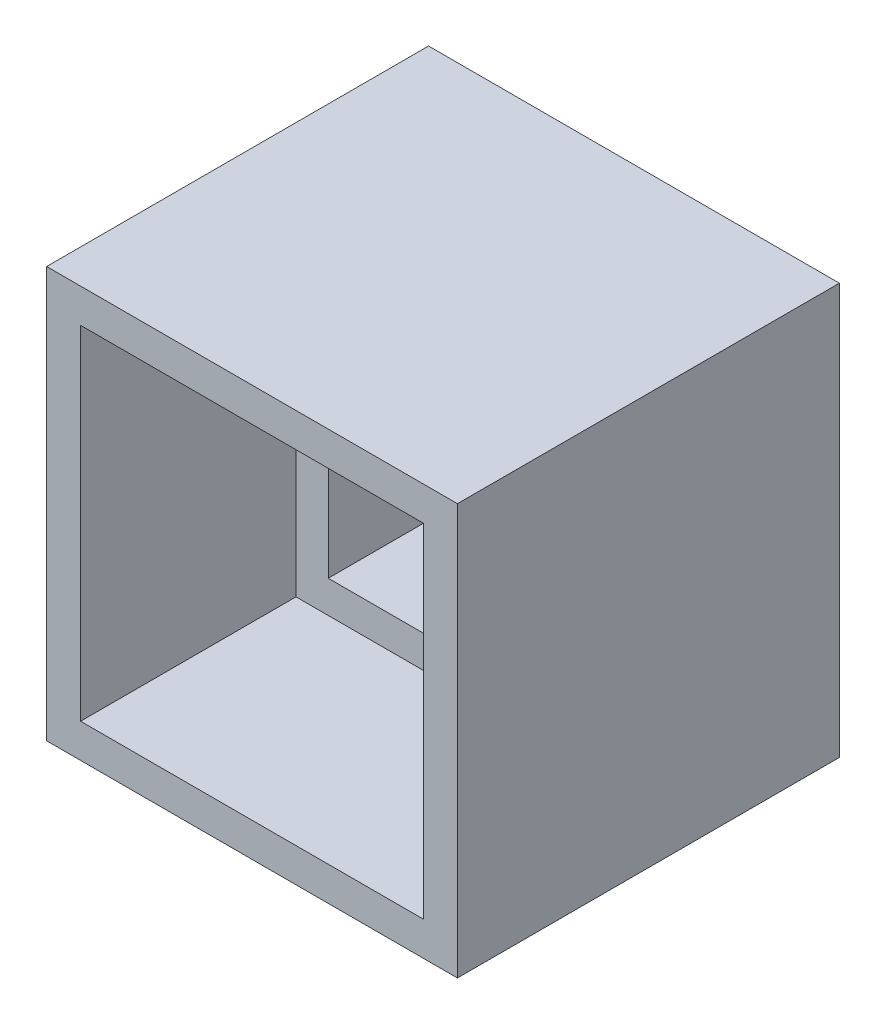
from build123d import *

# Parameters (mm, degrees)
BOSS_EXTRUDE1_DEPTH      = 50.8
BOSS_EXTRUDE1_DEPTH_BACK = 6.35
SKETCH1_W                = 61.468
SKETCH1_H                = 61.468
SKETCH1_3_W              = 41.656
SKETCH1_3_H              = 41.656
CUT_EXTRUDE1_DEPTH       = 67.856544272
SKETCH5_W                = 38.1
SKETCH5_H                = 38.1
CUT_EXTRUDE3_DEPTH       = 72.800278635
SKETCH7_W                = 51.308
SKETCH7_H                = 51.308
CUT_EXTRUDE4_DEPTH       = 55.111902709


with BuildPart() as part:
    # Sketch1 → Boss-Extrude1 (new, two sides: drawn at the far end of the back side and taken through both)
    with BuildSketch(Plane.XY.offset(-BOSS_EXTRUDE1_DEPTH_BACK)):
        Rectangle(SKETCH1_W, SKETCH1_H)
    extrude(amount=BOSS_EXTRUDE1_DEPTH + BOSS_EXTRUDE1_DEPTH_BACK)

    # Sketch1<3> → Cut-Extrude1 (cut, through all)
    with BuildSketch(Plane.XY):
        Rectangle(SKETCH1_3_W, SKETCH1_3_H)
    extrude(amount=CUT_EXTRUDE1_DEPTH, mode=Mode.SUBTRACT)

    # Sketch5 → Cut-Extrude3 (cut, through all)
    with BuildSketch(Plane(origin=(0, 0, -6.35), x_dir=(-1, 0, 0), z_dir=(0, 0, -1))):
        Rectangle(SKETCH5_W, SKETCH5_H)
    extrude(amount=-CUT_EXTRUDE3_DEPTH, mode=Mode.SUBTRACT)

    # Sketch7 → Cut-Extrude4 (cut, through all)
    with BuildSketch(Plane(origin=(0, 0, 18.5674), x_dir=(-1, 0, 0), z_dir=(0, 0, -1))):
        Rectangle(SKETCH7_W, SKETCH7_H)
    extrude(amount=-CUT_EXTRUDE4_DEPTH, mode=Mode.SUBTRACT)


solid = part.part
